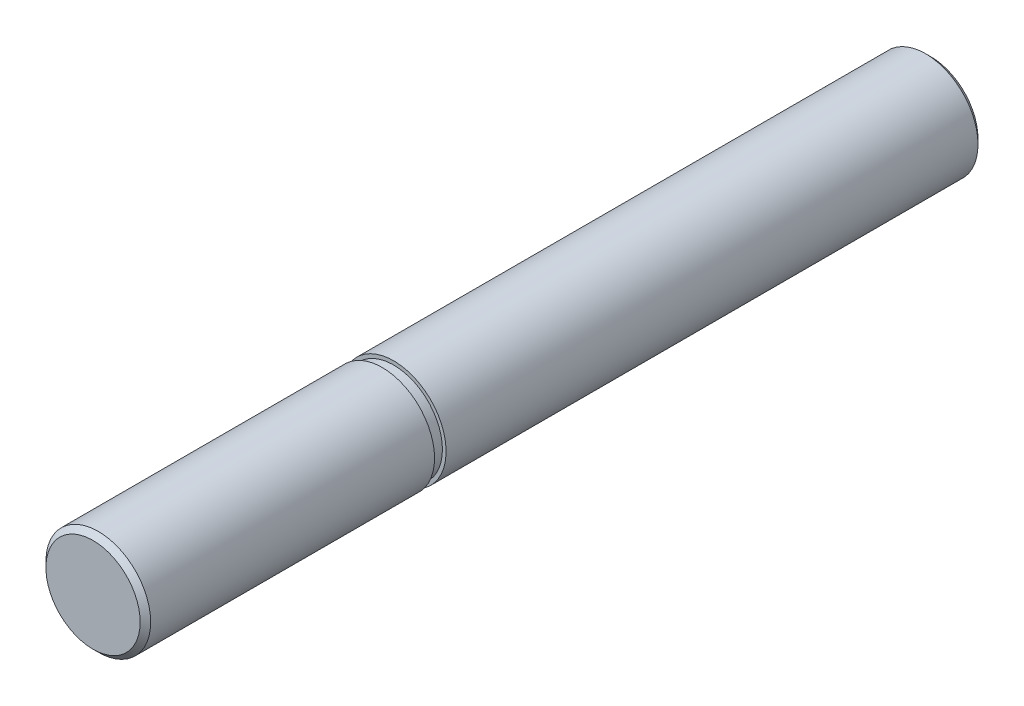
from build123d import *

# Parameters (mm, degrees)
SKETCH_1_R      = 5
EXTRUDE_1_DEPTH = 80
CHAMFER_1_SIZE  = 0.5
SKETCH_2_W      = 2.220028262
SKETCH_2_H      = 1.1


with BuildPart() as part:
    # 草图1 → 拉伸1 (new body)
    with BuildSketch(Plane.XY):
        Circle(SKETCH_1_R)
    extrude(amount=EXTRUDE_1_DEPTH)

    # 倒角1
    chamfer_1_edges = [part.edges().sort_by_distance(p)[0] for p in [
        (-5, 0, 0),
        (-5, 0, 80),
    ]]
    chamfer(chamfer_1_edges, length=CHAMFER_1_SIZE)

    # 草图2 → 切除-旋转1 (revolve, cut)
    with BuildSketch(Plane(origin=(0, 0, 0), x_dir=(1, 0, 0), z_dir=(0, 1, 0))):
        with Locations((5.760014131, -51.839999917)):
            Rectangle(SKETCH_2_W, SKETCH_2_H)
    revolve(axis=Axis((0, 0, 80), (0, 0, -1)), mode=Mode.SUBTRACT)


solid = part.part
